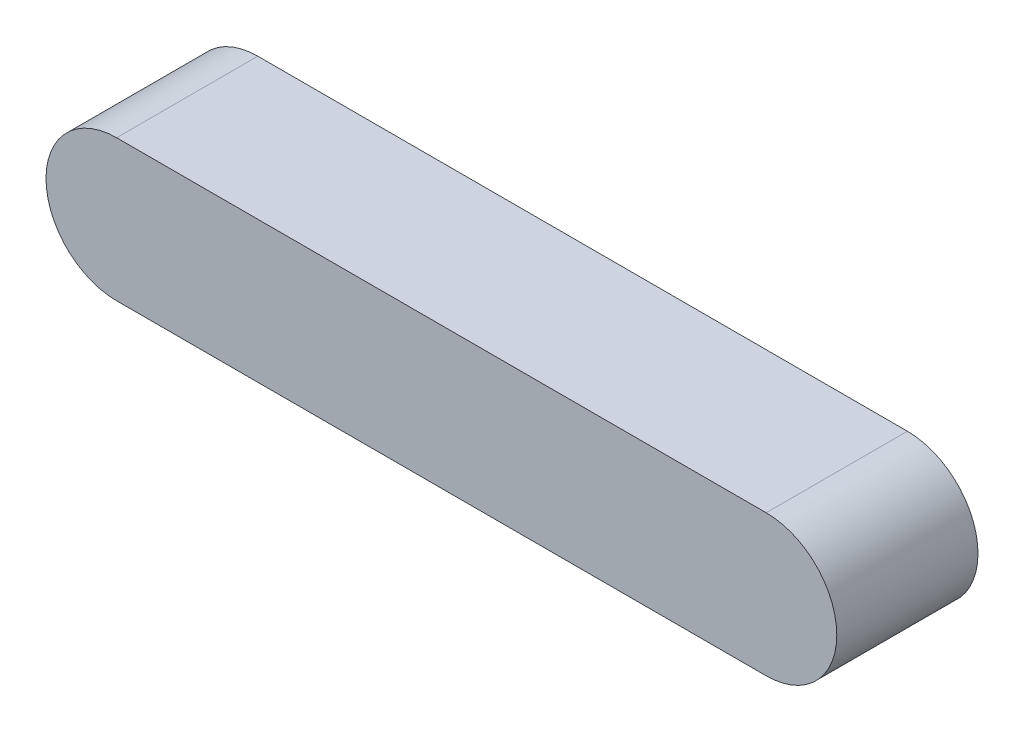
from build123d import *

# Parameters (mm, degrees)
BOSS_EXTRUDE2_DEPTH = 5


with BuildPart() as part:
    # Sketch2 → Boss-Extrude2 (new body)
    with BuildSketch(Plane.XY):
        with BuildLine():
            Line((26.767496244, 2.5), (49.767496244, 2.5))
            ThreePointArc((49.767496244, 2.5), (52.267496244, 0), (49.767496244, -2.5))
            Line((49.767496244, -2.5), (26.767496244, -2.5))
            ThreePointArc((26.767496244, -2.5), (24.267496244, 0), (26.767496244, 2.5))
        make_face()
    extrude(amount=BOSS_EXTRUDE2_DEPTH)


solid = part.part
